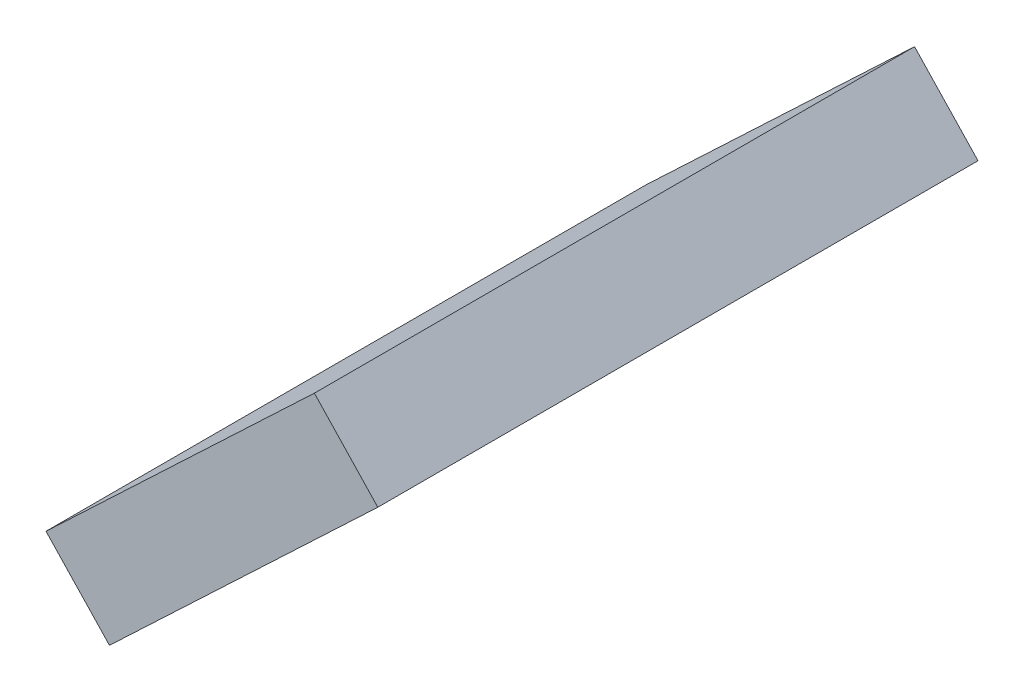
from build123d import *

# Parameters (mm, degrees)
BOSS_EXTRUDE2_DEPTH = 130


with BuildPart() as part:
    # Sketch1 → Boss-Extrude2 (new body)
    with BuildSketch(Plane.XY):
        Polygon((-379.251734041, -354.256359802), (-321.122567878, -299.292735092), (-307.381661701, -313.825026632), (-365.510827863, -368.788651342), align=None)
    extrude(amount=BOSS_EXTRUDE2_DEPTH)


solid = part.part
